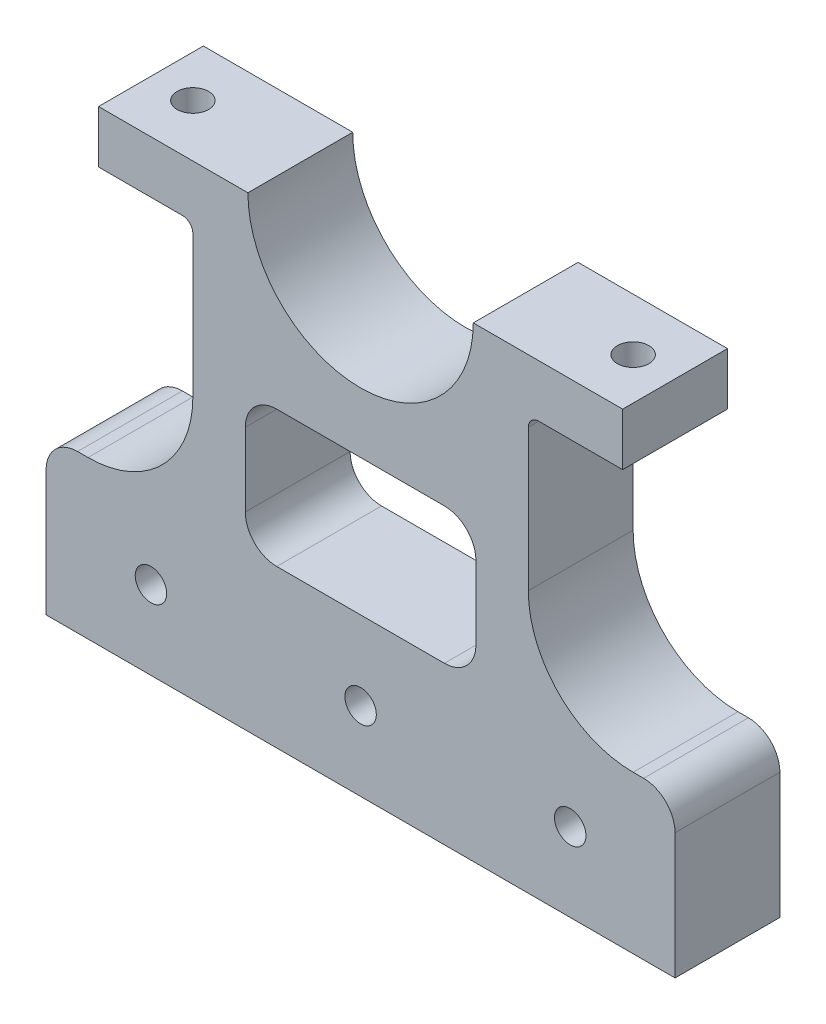
from build123d import *

# Parameters (mm, degrees)
EXTRUDE_1_DEPTH     = 10
SKETCH_3_R          = 10.75
CUT_EXTRUDE_1_DEPTH = 55.591666031
SKETCH_4_R          = 1.5
CUT_EXTRUDE_2_DEPTH = 55.591666031
FILLET_1_R          = 10
FILLET_3_R          = 3
SKETCH_7_W          = 22
SKETCH_7_H          = 13
CUT_EXTRUDE_5_DEPTH = 55.591666031
FILLET_4_R          = 3
SKETCH_8_W          = 9
SKETCH_8_H          = 5
EXTRUDE_2_DEPTH     = 10
FILLET_5_R          = 1
SKETCH_9_R          = 1.5
CUT_EXTRUDE_6_DEPTH = 5


with BuildPart() as part:
    # 草图2 → 凸台-拉伸1 (new body)
    with BuildSketch(Plane.XY):
        Polygon((30, 0), (-30, 0), (-30, 15), (-16, 15), (-16, 44.5), (16, 44.5), (16, 15), (30, 15), align=None)
    extrude(amount=EXTRUDE_1_DEPTH)

    # 草图3 → 切除-拉伸1 (cut, through all)
    with BuildSketch(Plane.XY.offset(10)):
        with Locations((0, 44.5)):
            Circle(SKETCH_3_R)
    extrude(amount=-CUT_EXTRUDE_1_DEPTH, mode=Mode.SUBTRACT)

    # 草图4 → 切除-拉伸2 (cut, through all)
    with BuildSketch(Plane.XY.offset(10)):
        with Locations((-20, 7.5)):
            Circle(SKETCH_4_R)
        with Locations((0, 7.5)):
            Circle(SKETCH_4_R)
        with Locations((20, 7.5)):
            Circle(SKETCH_4_R)
    extrude(amount=-CUT_EXTRUDE_2_DEPTH, mode=Mode.SUBTRACT)

    # 圆角1
    fillet_1_edges = [part.edges().sort_by_distance(p)[0] for p in [
        (-16, 15, 5),
        (16, 15, 5),
    ]]
    fillet(fillet_1_edges, radius=FILLET_1_R)

    # 圆角3
    fillet_3_edges = [part.edges().sort_by_distance(p)[0] for p in [
        (-30, 15, 5),
        (30, 15, 5),
    ]]
    fillet(fillet_3_edges, radius=FILLET_3_R)

    # 草图7 → 切除-拉伸5 (cut, through all)
    with BuildSketch(Plane.XY.offset(10)):
        with Locations((0, 21.5)):
            Rectangle(SKETCH_7_W, SKETCH_7_H)
    extrude(amount=-CUT_EXTRUDE_5_DEPTH, mode=Mode.SUBTRACT)

    # 圆角4
    fillet_4_edges = [part.edges().sort_by_distance(p)[0] for p in [
        (11, 28, 5),
        (11, 15, 5),
        (-11, 15, 5),
        (-11, 28, 5),
    ]]
    fillet(fillet_4_edges, radius=FILLET_4_R)

    # 草图8 → 凸台-拉伸2 (add)
    with BuildSketch(Plane.XY.offset(10)):
        with Locations((20.5, 42)):
            Rectangle(SKETCH_8_W, SKETCH_8_H)
        with Locations((-20.5, 42)):
            Rectangle(SKETCH_8_W, SKETCH_8_H)
    extrude(amount=-EXTRUDE_2_DEPTH)

    # 圆角5
    fillet_5_edges = [part.edges().sort_by_distance(p)[0] for p in [
        (-16, 39.5, 5),
        (16, 39.5, 5),
    ]]
    fillet(fillet_5_edges, radius=FILLET_5_R)

    # 草图9 → 切除-拉伸6 (cut)
    with BuildSketch(Plane(origin=(0, 44.5, 0), x_dir=(1, 0, 0), z_dir=(0, 1, 0))):
        with Locations(Location((-21, -5, 0), (0, 0, 270))):
            Circle(SKETCH_9_R)
        with Locations(Location((21, -5, 0), (0, 0, 90))):
            Circle(SKETCH_9_R)
    extrude(amount=-CUT_EXTRUDE_6_DEPTH, mode=Mode.SUBTRACT)


solid = part.part
